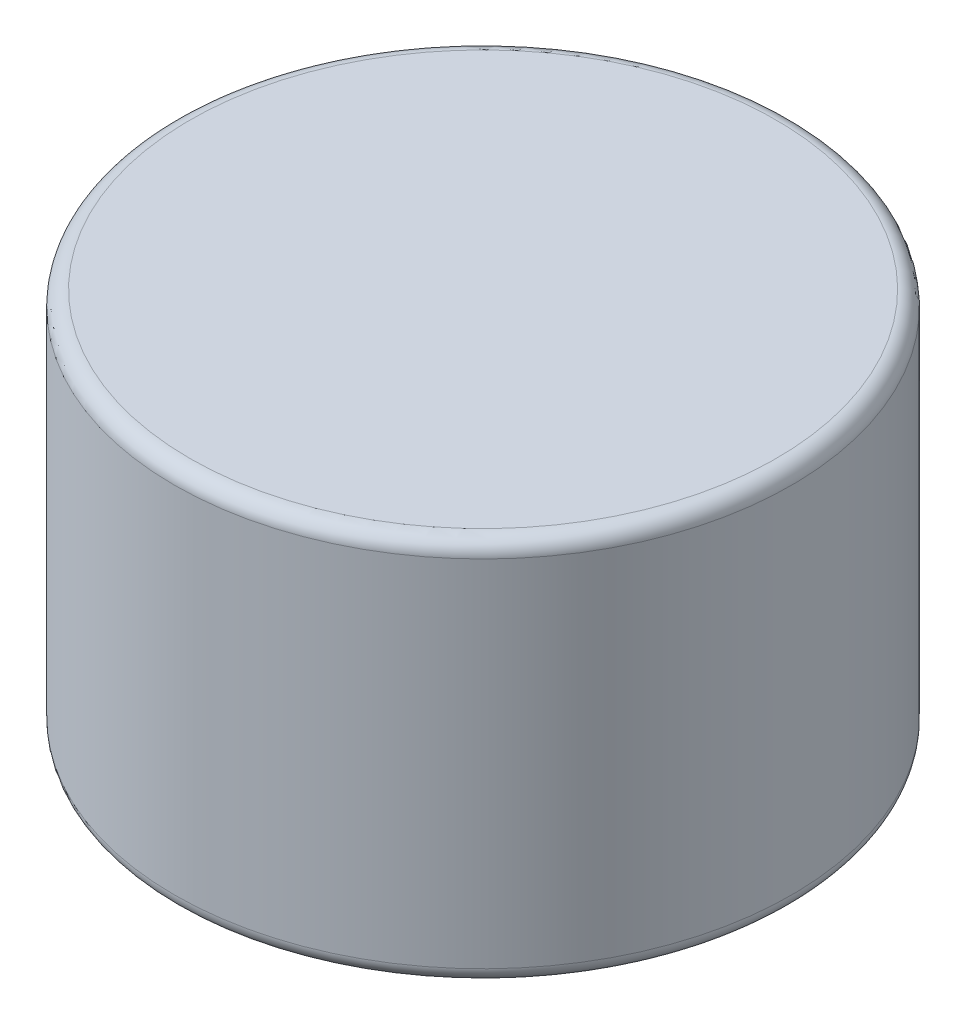
from build123d import *

# Parameters (mm, degrees)
SKETCH_1_R      = 4
EXTRUDE_1_DEPTH = 5
FILLET_1_R      = 0.2


with BuildPart() as part:
    # Эскиз1 → Бобышка-Вытянуть1 (new body)
    with BuildSketch(Plane(origin=(0, 0, 0), x_dir=(1, 0, 0), z_dir=(0, 1, 0))):
        with Locations(Location((0, 0, 0), (0, 0, 270))):
            Circle(SKETCH_1_R)
    extrude(amount=EXTRUDE_1_DEPTH)

    # Скругление1
    fillet_1_edges = [part.edges().sort_by_distance(p)[0] for p in [
        (0, 0, -4),
        (0, 5, -4),
    ]]
    fillet(fillet_1_edges, radius=FILLET_1_R)


solid = part.part
